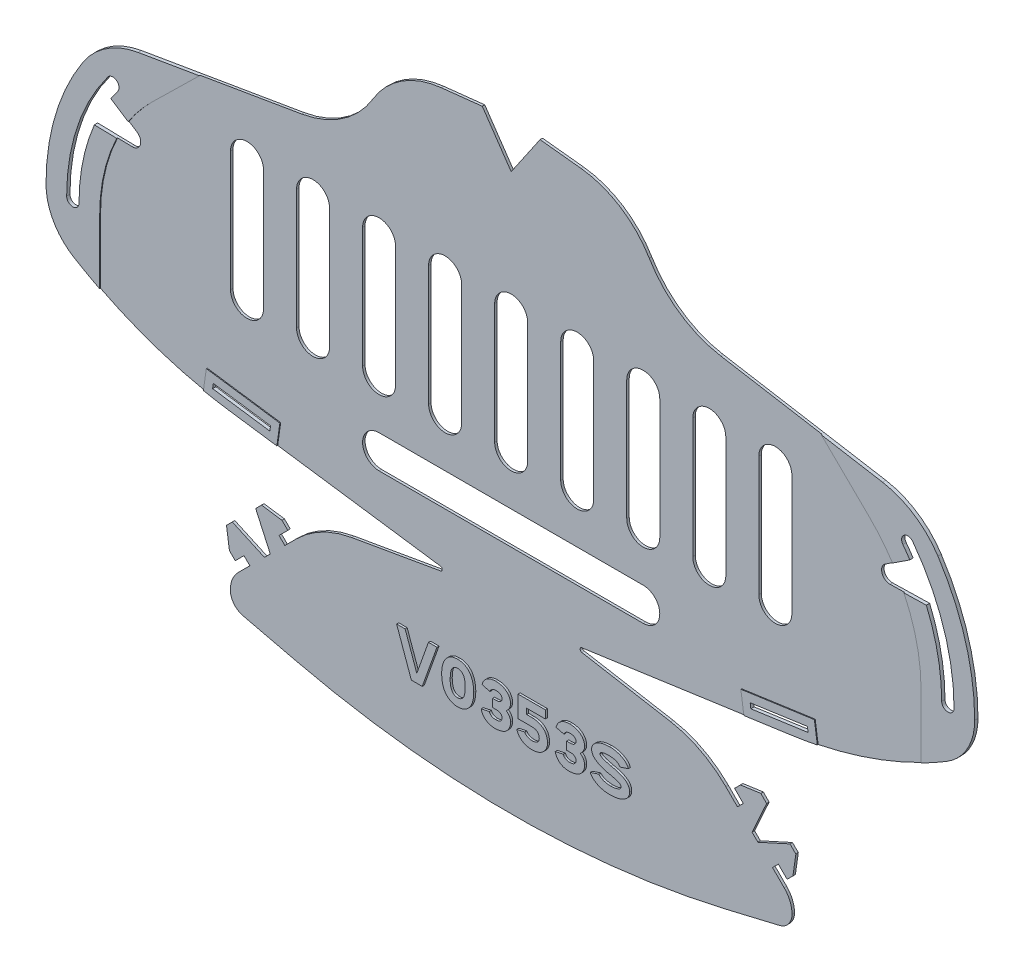
from build123d import *

# Parameters (mm, degrees)
MAIN_SHAPE_DEPTH                   = 0.6
ELASTIC_ATTACHMENT_POINTS_DEPTH    = 184.525502315
REINFORCED_ATTACHMENT_POINTS_DEPTH = 0.2
TAB_SLITS_DEPTH                    = 184.525502315
REINFORCED_TAB_SLITS_DEPTH         = 0.2
TAB_FLEX_RELIEF_DEPTH              = 184.525502315
TAB_FLEX_RELIEF_DEPTH_BACK         = 184.525502315
BREATHING_SLITS_DEPTH              = 184.525502315
VERSION_NUMBER_DEPTH               = 0.5
FILLET1_R                          = 0.5
CUT_EXTRUDE1_DEPTH                 = 184.526265229
CUT_EXTRUDE1_DEPTH_BACK            = 184.526265229


with BuildPart() as part:
    # Sketch1 → Main Shape (new body)
    with BuildSketch(Plane.XY):
        with BuildLine():
            Line((0, -10.235233266), (-7, 0))
            Line((-7, 0), (-16.941855461, -1.076805455))
            ThreePointArc((-16.941855461, -1.076805455), (-26.448172688, -4.42923559), (-33.461443341, -11.669600897))
            ThreePointArc((-33.461443341, -11.669600897), (-40.804108255, -19.481824954), (-50.74391922, -23.5))
            Line((-50.74391922, -23.5), (-90.180351554, -30.190874742))
            ThreePointArc((-90.180351554, -30.190874742), (-97.811505455, -33.190405434), (-103.597722286, -39))
            ThreePointArc((-103.597722286, -39), (-110.227482046, -53.35351039), (-112.5, -69))
            ThreePointArc((-112.5, -69), (-110.685143325, -75.893640703), (-105.711102551, -81))
            ThreePointArc((-105.711102551, -81), (-87.655491519, -89.524485559), (-68.266232563, -94.291935705))
            Line((-68.266232563, -94.291935705), (-14, -102))
            Line((-14, -102), (-38.626554922, -106.304973016))
            ThreePointArc((-38.626554922, -106.304973016), (-45.849449199, -108.748014338), (-52, -113.254607005))
            Line((-52, -113.254607005), (-54.828307349, -116.0831539))
            Line((-54.828307349, -116.0831539), (-56.242580797, -114.669000226))
            Line((-56.242580797, -114.669000226), (-54.121350285, -112.547590054))
            Line((-54.121350285, -112.547590054), (-55.535623732, -111.13343638))
            Line((-55.535623732, -111.13343638), (-60.48540114, -110.426539202))
            Line((-60.48540114, -110.426539202), (-68.970323187, -118.912179887))
            Line((-68.970323187, -118.912179887), (-68.263006804, -123.861897408))
            Line((-68.263006804, -123.861897408), (-66.848733357, -125.276051082))
            Line((-66.848733357, -125.276051082), (-64.727502845, -123.154640911))
            Line((-64.727502845, -123.154640911), (-63.313229397, -124.568794586))
            Line((-63.313229397, -124.568794586), (-66.141536747, -127.397341481))
            ThreePointArc((-66.141536747, -127.397341481), (-67.550417669, -129.506025763), (-68.045148042, -131.993340924))
            ThreePointArc((-68.045148042, -131.993340924), (-67.183295285, -134.473669911), (-64.9691321, -135.885159709))
            Line((-64.9691321, -135.885159709), (-52.436095294, -138.860716087))
            ThreePointArc((-52.436095294, -138.860716087), (-26.397134772, -143.459954927), (0, -145))
            ThreePointArc((0, -145), (26.397134772, -143.459954927), (52.436095294, -138.860716087))
            Line((52.436095294, -138.860716087), (64.9691321, -135.885159709))
            ThreePointArc((64.9691321, -135.885159709), (67.183295285, -134.473669911), (68.045148042, -131.993340924))
            ThreePointArc((68.045148042, -131.993340924), (67.550417669, -129.506025763), (66.141536747, -127.397341481))
            Line((66.141536747, -127.397341481), (63.313229397, -124.568794586))
            Line((63.313229397, -124.568794586), (64.727502845, -123.154640911))
            Line((64.727502845, -123.154640911), (66.848733357, -125.276051082))
            Line((66.848733357, -125.276051082), (68.263006804, -123.861897408))
            Line((68.263006804, -123.861897408), (68.970323187, -118.912179887))
            Line((68.970323187, -118.912179887), (60.48540114, -110.426539202))
            Line((60.48540114, -110.426539202), (55.535623732, -111.13343638))
            Line((55.535623732, -111.13343638), (54.121350285, -112.547590054))
            Line((54.121350285, -112.547590054), (56.242580797, -114.669000226))
            Line((56.242580797, -114.669000226), (54.828307349, -116.0831539))
            Line((54.828307349, -116.0831539), (52, -113.254607005))
            ThreePointArc((52, -113.254607005), (45.849449199, -108.748014338), (38.626554922, -106.304973016))
            Line((38.626554922, -106.304973016), (14, -102))
            Line((14, -102), (68.266232563, -94.291935705))
            ThreePointArc((68.266232563, -94.291935705), (87.655491519, -89.524485559), (105.711102551, -81))
            ThreePointArc((105.711102551, -81), (110.685143325, -75.893640703), (112.5, -69))
            ThreePointArc((112.5, -69), (110.227482046, -53.35351039), (103.597722286, -39))
            ThreePointArc((103.597722286, -39), (97.811505455, -33.190405434), (90.180351554, -30.190874742))
            Line((90.180351554, -30.190874742), (50.74391922, -23.5))
            ThreePointArc((50.74391922, -23.5), (40.804108255, -19.481824954), (33.461443341, -11.669600897))
            ThreePointArc((33.461443341, -11.669600897), (26.448172688, -4.42923559), (16.941855461, -1.076805455))
            Line((16.941855461, -1.076805455), (7, 0))
            Line((7, 0), (0, -10.235233266))
        make_face()
    extrude(amount=MAIN_SHAPE_DEPTH)

    # Sketch2 → Elastic Attachment Points (cut, through all)
    with BuildSketch(Plane.XY.offset(0.6)):
        with BuildLine():
            ThreePointArc((-97.5, -39), (-104.934164903, -53.188611699), (-107.5, -69))
            ThreePointArc((-107.5, -69), (-106, -70.5), (-104.5, -69))
            ThreePointArc((-104.5, -69), (-102.088115008, -54.137294997), (-95.1, -40.8))
            ThreePointArc((-95.1, -40.8), (-95.4, -38.7), (-97.5, -39))
        make_face()
        with BuildLine():
            ThreePointArc((97.5, -39), (104.934164903, -53.188611699), (107.5, -69))
            ThreePointArc((107.5, -69), (106, -70.5), (104.5, -69))
            ThreePointArc((104.5, -69), (102.088115008, -54.137294997), (95.1, -40.8))
            ThreePointArc((95.1, -40.8), (95.4, -38.7), (97.5, -39))
        make_face()
    extrude(amount=-ELASTIC_ATTACHMENT_POINTS_DEPTH, mode=Mode.SUBTRACT)

    # Sketch7 → Reinforced Attachment Points (add)
    # profile 1 of 2: a face of its own
    with BuildSketch(Plane.XY.offset(0.6)):
        with BuildLine():
            Line((-99.5, -69), (-99.5, -84.438405623))
            ThreePointArc((-99.5, -84.438405623), (-102.636073846, -82.774338486), (-105.711102551, -81))
            ThreePointArc((-105.711102551, -81), (-110.685143325, -75.893640703), (-112.5, -69))
            ThreePointArc((-112.5, -69), (-110.227482046, -53.35351039), (-103.597722286, -39))
            ThreePointArc((-103.597722286, -39), (-97.811505455, -33.190405434), (-90.180351554, -30.190874742))
            Line((-90.180351554, -30.190874742), (-75.331937335, -27.671659038))
            Line((-75.331937335, -27.671659038), (-86.893876913, -39))
            ThreePointArc((-86.893876913, -39), (-96.22042633, -52.729517991), (-99.5, -69))
        make_face()
        with BuildLine():
            ThreePointArc((-107.5, -69), (-106, -70.5), (-104.5, -69))
            ThreePointArc((-104.5, -69), (-102.088115008, -54.137294997), (-95.1, -40.8))
            ThreePointArc((-95.1, -40.8), (-95.4, -38.7), (-97.5, -39))
            ThreePointArc((-97.5, -39), (-104.934164903, -53.188611699), (-107.5, -69))
        make_face(mode=Mode.SUBTRACT)
    # profile 2 of 2: a face of its own
    with BuildSketch(Plane.XY.offset(0.6)):
        with BuildLine():
            Line((75.331937335, -27.671659038), (90.180351554, -30.190874742))
            ThreePointArc((90.180351554, -30.190874742), (97.811505455, -33.190405434), (103.597722286, -39))
            ThreePointArc((103.597722286, -39), (110.227482046, -53.35351039), (112.5, -69))
            ThreePointArc((112.5, -69), (110.685143325, -75.893640703), (105.711102551, -81))
            ThreePointArc((105.711102551, -81), (102.636073846, -82.774338486), (99.5, -84.438405623))
            Line((99.5, -84.438405623), (99.5, -69))
            ThreePointArc((99.5, -69), (96.22042633, -52.729517991), (86.893876913, -39))
            Line((86.893876913, -39), (75.331937335, -27.671659038))
        make_face()
        with BuildLine():
            ThreePointArc((104.5, -69), (106, -70.5), (107.5, -69))
            ThreePointArc((107.5, -69), (104.934164903, -53.188611699), (97.5, -39))
            ThreePointArc((97.5, -39), (95.4, -38.7), (95.1, -40.8))
            ThreePointArc((95.1, -40.8), (102.088115008, -54.137294997), (104.5, -69))
        make_face(mode=Mode.SUBTRACT)
    extrude(amount=REINFORCED_ATTACHMENT_POINTS_DEPTH)

    # Sketch6 → Tab Slits (cut, through all)
    with BuildSketch(Plane.XY.offset(0.6)):
        Polygon((-72.13241053, -91.7227024), (-58.271539531, -93.691523152), (-58.102783467, -92.503448495), (-71.963654466, -90.534627743), align=None)
        Polygon((72.13241053, -91.7227024), (71.963654466, -90.534627743), (58.102783467, -92.503448495), (58.271539531, -93.691523152), align=None)
    extrude(amount=-TAB_SLITS_DEPTH, mode=Mode.SUBTRACT)

    # Sketch9 → Reinforced Tab Slits (add)
    # profile 1 of 2: a face of its own
    with BuildSketch(Plane.XY.offset(0.6)):
        with BuildLine():
            Line((-56.57267521, -95.952907688), (-55.841398931, -90.804584174))
            Line((-55.841398931, -90.804584174), (-73.662518786, -88.273243207))
            Line((-73.662518786, -88.273243207), (-74.366835359, -93.231765281))
            ThreePointArc((-74.366835359, -93.231765281), (-71.324741696, -93.809080757), (-68.266232563, -94.291935705))
            Line((-68.266232563, -94.291935705), (-56.57267521, -95.952907688))
        make_face()
        Polygon((-58.271539531, -93.691523152), (-58.102783467, -92.503448495), (-71.963654466, -90.534627743), (-72.13241053, -91.7227024), align=None, mode=Mode.SUBTRACT)
    # profile 2 of 2: a face of its own
    with BuildSketch(Plane.XY.offset(0.6)):
        with BuildLine():
            Line((68.266232563, -94.291935705), (56.57267521, -95.952907688))
            Line((56.57267521, -95.952907688), (55.841398931, -90.804584174))
            Line((55.841398931, -90.804584174), (73.662518786, -88.273243207))
            Line((73.662518786, -88.273243207), (74.366835359, -93.231765281))
            ThreePointArc((74.366835359, -93.231765281), (71.324741696, -93.809080757), (68.266232563, -94.291935705))
        make_face()
        Polygon((58.102783467, -92.503448495), (71.963654466, -90.534627743), (72.13241053, -91.7227024), (58.271539531, -93.691523152), align=None, mode=Mode.SUBTRACT)
    extrude(amount=REINFORCED_TAB_SLITS_DEPTH)

    # Sketch11 → Tab Flex Relief (cut, two sides: drawn at the far end of the back side and taken through both)
    with BuildSketch(Plane.XY.offset(0.6).offset(-TAB_FLEX_RELIEF_DEPTH_BACK)):
        Polygon((-67.556169513, -117.49790644), (-59.777845211, -121.033110967), (-58.363691536, -119.618837519), (-61.899554814, -111.840812649), align=None)
        Polygon((61.899554814, -111.840812649), (67.556169513, -117.49790644), (59.777845211, -121.033110967), (58.363691536, -119.618837519), align=None)
    extrude(amount=TAB_FLEX_RELIEF_DEPTH + TAB_FLEX_RELIEF_DEPTH_BACK, mode=Mode.SUBTRACT)

    # Sketch3 → Breathing Slits (cut, through all)
    with BuildSketch(Plane.XY.offset(0.6)):
        with BuildLine():
            Line((4, -39.9), (4, -69))
            ThreePointArc((4, -69), (0, -73), (-4, -69))
            Line((-4, -69), (-4, -39.9))
            ThreePointArc((-4, -39.9), (0, -35.9), (4, -39.9))
        make_face()
        with BuildLine():
            Line((-12, -39.9), (-12, -69))
            ThreePointArc((-12, -69), (-16, -73), (-20, -69))
            Line((-20, -69), (-20, -39.9))
            ThreePointArc((-20, -39.9), (-16, -35.9), (-12, -39.9))
        make_face()
        with BuildLine():
            Line((-28, -39.9), (-28, -69))
            ThreePointArc((-28, -69), (-32, -73), (-36, -69))
            Line((-36, -69), (-36, -39.9))
            ThreePointArc((-36, -39.9), (-32, -35.9), (-28, -39.9))
        make_face()
        with BuildLine():
            Line((-32, -81), (32, -81))
            ThreePointArc((32, -81), (36, -85), (32, -89))
            Line((32, -89), (-32, -89))
            ThreePointArc((-32, -89), (-36, -85), (-32, -81))
        make_face()
        with BuildLine():
            Line((-44, -39.9), (-44, -69))
            ThreePointArc((-44, -69), (-48, -73), (-52, -69))
            Line((-52, -69), (-52, -39.9))
            ThreePointArc((-52, -39.9), (-48, -35.9), (-44, -39.9))
        make_face()
        with BuildLine():
            Line((-60, -39.9), (-60, -69))
            ThreePointArc((-60, -69), (-64, -73), (-68, -69))
            Line((-68, -69), (-68, -39.9))
            ThreePointArc((-68, -39.9), (-64, -35.9), (-60, -39.9))
        make_face()
        with BuildLine():
            Line((12, -39.9), (12, -69))
            ThreePointArc((12, -69), (16, -73), (20, -69))
            Line((20, -69), (20, -39.9))
            ThreePointArc((20, -39.9), (16, -35.9), (12, -39.9))
        make_face()
        with BuildLine():
            Line((28, -39.9), (28, -69))
            ThreePointArc((28, -69), (32, -73), (36, -69))
            Line((36, -69), (36, -39.9))
            ThreePointArc((36, -39.9), (32, -35.9), (28, -39.9))
        make_face()
        with BuildLine():
            Line((44, -39.9), (44, -69))
            ThreePointArc((44, -69), (48, -73), (52, -69))
            Line((52, -69), (52, -39.9))
            ThreePointArc((52, -39.9), (48, -35.9), (44, -39.9))
        make_face()
        with BuildLine():
            Line((60, -39.9), (60, -69))
            ThreePointArc((60, -69), (64, -73), (68, -69))
            Line((68, -69), (68, -39.9))
            ThreePointArc((68, -39.9), (64, -35.9), (60, -39.9))
        make_face()
    extrude(amount=-BREATHING_SLITS_DEPTH, mode=Mode.SUBTRACT)

    # Sketch8 → Version Number (add)
    # profile 1 of 6: a face of its own
    with BuildSketch(Plane.XY.offset(0.6)):
        Polygon((-23.68563445, -128.5), (-21.050713815, -128.5), (-17.479285243, -118.5), (-19.542777307, -118.5), (-22.368174132, -126.420634921), (-25.193570958, -118.5), (-27.257063021, -118.5), align=None)
    # profile 2 of 6: a face of its own
    with BuildSketch(Plane.XY.offset(0.6)):
        with BuildLine():
            add(Edge.make_bspline(
                [(-12.457110564, -118.5), (-12.601476528, -118.505695671), (-12.884231675, -118.51685121), (-13.297366677, -118.5745591), (-13.68520938, -118.680335178), (-14.052410955, -118.819656178), (-14.394686527, -119.003303471), (-14.718479702, -119.221085059), (-15.011490317, -119.487440084), (-15.28694537, -119.785519386), (-15.53280855, -120.12453761), (-15.74624426, -120.500892889), (-15.928207036, -120.912503383), (-16.0771282, -121.360169436), (-16.192677248, -121.844506854), (-16.280431187, -122.364485904), (-16.331985627, -122.921030718), (-16.342642357, -123.303893775), (-16.348120938, -123.500722112)],
                knots=[0, 0, 0, 0, 0.970159994, 1.900155169, 2.79438565, 3.665191596, 4.532301255, 5.397946305, 6.279238358, 7.185391655, 8.120220805, 9.085107467, 10.08639026, 11.138349125, 12.249459105, 13.427760297, 14.677622047, 16, 16, 16, 16], degree=3))
            add(Edge.make_bspline(
                [(-16.348120938, -123.500722112), (-16.342697547, -123.69832053), (-16.332188921, -124.081196856), (-16.280221851, -124.637697099), (-16.192775961, -125.156966907), (-16.076666105, -125.641884177), (-15.928723442, -126.090648826), (-15.746176817, -126.502814664), (-15.532866512, -126.879260377), (-15.286785332, -127.218032326), (-15.012393595, -127.51659595), (-14.716926049, -127.779877259), (-14.395574806, -128.000979952), (-14.052217501, -128.183632701), (-13.685664447, -128.324409639), (-13.296711367, -128.425104033), (-12.884933047, -128.488808035), (-12.602151673, -128.496221224), (-12.458007598, -128.5)],
                knots=[0, 0, 0, 0, 1.327400251, 2.57203543, 3.750234214, 4.861247624, 5.917991082, 6.919186852, 7.883989653, 8.818737555, 9.724812096, 10.602616666, 11.47109776, 12.338132057, 13.208862319, 14.101698703, 15.032365954, 16, 16, 16, 16], degree=3))
            add(Edge.make_bspline(
                [(-12.458007598, -128.5), (-12.313867929, -128.496210687), (-12.0310952, -128.488776824), (-11.619254786, -128.425221319), (-11.229832454, -128.323813307), (-10.862470976, -128.184839888), (-10.520081497, -128.000200623), (-10.199035091, -127.779984633), (-9.903636422, -127.516566079), (-9.629226622, -127.218040576), (-9.383145995, -126.879258594), (-9.169853253, -126.502813072), (-8.987231376, -126.090657611), (-8.839593638, -125.641847927), (-8.722280788, -125.157235462), (-8.639838642, -124.637275213), (-8.582182417, -124.081441513), (-8.574272049, -123.698369528), (-8.570190665, -123.500722112)],
                knots=[0, 0, 0, 0, 0.96765053, 1.898333634, 2.791185227, 3.666728435, 4.529238626, 5.397734515, 6.275554038, 7.181644014, 8.116407839, 9.081227075, 10.082439899, 11.139201358, 12.250233695, 13.427610983, 14.672766316, 16, 16, 16, 16], degree=3))
            add(Edge.make_bspline(
                [(-8.570190665, -123.500722112), (-8.574331494, -123.303845261), (-8.582388199, -122.920787111), (-8.639632178, -122.364907693), (-8.722380372, -121.844238468), (-8.839130008, -121.360205444), (-8.987747973, -120.912494629), (-9.169785791, -120.500894477), (-9.383203968, -120.124539393), (-9.629066562, -119.785511139), (-9.904539799, -119.487469991), (-10.197481007, -119.220977415), (-10.52096587, -119.004075275), (-10.862277518, -118.818455332), (-11.230288081, -118.680915067), (-11.618604713, -118.574534625), (-12.031453791, -118.516562336), (-12.313938622, -118.506550382), (-12.458007598, -118.501444225)],
                knots=[0, 0, 0, 0, 1.322391154, 2.572941942, 3.750582404, 4.861863084, 5.913983562, 6.915420183, 7.880455081, 8.815427849, 9.721720359, 10.603147806, 11.468925845, 12.331628829, 13.207367743, 14.101735605, 15.031873656, 16, 16, 16, 16], degree=3))
            Line((-12.458007598, -118.501444225), (-12.457110564, -118.5))
        make_face()
        with BuildLine():
            add(Edge.make_bspline(
                [(-12.457110564, -126.579365079), (-12.526430112, -126.580142247), (-12.662440437, -126.581667111), (-12.859893674, -126.549518886), (-13.046344769, -126.50001124), (-13.220522065, -126.424863461), (-13.384317425, -126.32888552), (-13.534932969, -126.207295998), (-13.673291992, -126.063513987), (-13.80060705, -125.896932623), (-13.914478352, -125.703005633), (-14.013009341, -125.478827118), (-14.093746756, -125.222713054), (-14.162923514, -124.937433189), (-14.214174879, -124.621763618), (-14.252678444, -124.276117752), (-14.278545108, -123.899148475), (-14.281904383, -123.63702081), (-14.283651108, -123.500722112)],
                knots=[0, 0, 0, 0, 0.820209436, 1.609314487, 2.362064528, 3.101854642, 3.850272983, 4.605479342, 5.3882482, 6.210255141, 7.084711649, 8.047345167, 9.106040688, 10.263495908, 11.523832392, 12.893430008, 14.384674726, 16, 16, 16, 16], degree=3))
            add(Edge.make_bspline(
                [(-14.283651108, -123.500722112), (-14.281897496, -123.364424703), (-14.278524977, -123.102299516), (-14.252749333, -122.725313211), (-14.213856358, -122.378974061), (-14.163560074, -122.063111109), (-14.093342651, -121.778059679), (-14.01303962, -121.522619394), (-13.91450946, -121.298401339), (-13.8004748, -121.104640769), (-13.674084496, -120.937923887), (-13.53412201, -120.796456824), (-13.384401259, -120.674830172), (-13.220561374, -120.578630118), (-13.045915354, -120.50465551), (-12.860547807, -120.450210023), (-12.662404099, -120.423926373), (-12.526960826, -120.422146526), (-12.458007598, -120.421240419)],
                knots=[0, 0, 0, 0, 1.616177311, 3.108208617, 4.478528655, 5.748482895, 6.897727805, 7.956981757, 8.920123036, 9.795040793, 10.617481319, 11.394165711, 12.149770419, 12.898583529, 13.63876386, 14.394368568, 15.182584207, 16, 16, 16, 16], degree=3))
            add(Edge.make_bspline(
                [(-12.458007598, -120.421240419), (-12.389055963, -120.422149219), (-12.253615818, -120.423934355), (-12.055449598, -120.450179948), (-11.87016301, -120.504762296), (-11.695829663, -120.577982734), (-11.533604328, -120.675595023), (-11.38413457, -120.796360516), (-11.244234324, -120.937948802), (-11.117870012, -121.104645093), (-11.003645274, -121.298351736), (-10.905859994, -121.523063414), (-10.821900135, -121.777554553), (-10.752711036, -122.063195246), (-10.702081358, -122.378948588), (-10.663289243, -122.725320897), (-10.637483579, -123.102297333), (-10.634115428, -123.364423957), (-10.632364088, -123.500722112)],
                knots=[0, 0, 0, 0, 0.817669415, 1.606129616, 2.361968767, 3.102378757, 3.843623451, 4.599462602, 5.376387978, 6.199083685, 7.074272906, 8.037713021, 9.100132017, 10.249733507, 11.520081779, 12.89082699, 14.383321233, 16, 16, 16, 16], degree=3))
            add(Edge.make_bspline(
                [(-10.632364088, -123.500722112), (-10.634108542, -123.637021556), (-10.63746345, -123.899150658), (-10.663360125, -124.276110066), (-10.701763075, -124.621789015), (-10.753346294, -124.937349474), (-10.821488159, -125.223220708), (-10.905889671, -125.478383327), (-11.003676527, -125.703055181), (-11.117737705, -125.896928348), (-11.245026848, -126.063488884), (-11.383322938, -126.207393621), (-11.533687028, -126.328120602), (-11.695868255, -126.425517476), (-11.869733505, -126.499891817), (-12.056102843, -126.549600883), (-12.253292471, -126.581404352), (-12.388991007, -126.580608552), (-12.458007598, -126.580203806)],
                knots=[0, 0, 0, 0, 1.616177474, 3.108208932, 4.478529109, 5.739530511, 6.897596372, 7.959685938, 8.922827315, 9.797745161, 10.620185771, 11.403367596, 12.15897238, 12.899987232, 13.640167639, 14.39331481, 15.182836171, 16, 16, 16, 16], degree=3))
            Line((-12.458007598, -126.580203806), (-12.457110564, -126.579365079))
        make_face(mode=Mode.SUBTRACT)
    # profile 3 of 6: a face of its own
    with BuildSketch(Plane.XY.offset(0.6)):
        with BuildLine():
            Line((-3.134505757, -124.404761905), (-3.039267661, -124.404761905))
            add(Edge.make_bspline(
                [(-3.039267661, -124.404761905), (-2.938999766, -124.411299477), (-2.748364565, -124.423729091), (-2.481698268, -124.486416557), (-2.24890418, -124.578961335), (-2.057216802, -124.709274647), (-1.903571501, -124.861365804), (-1.789244062, -125.032278467), (-1.719582818, -125.222537651), (-1.710707381, -125.355662585), (-1.706230349, -125.422814713)],
                knots=[0, 0, 0, 0, 1.293250512, 2.458803691, 3.516087315, 4.504014474, 5.424976382, 6.287022232, 7.135923681, 8, 8, 8, 8], degree=3))
            add(Edge.make_bspline(
                [(-1.706230349, -125.422814713), (-1.7095199, -125.504440638), (-1.715880886, -125.662280257), (-1.785028257, -125.887718235), (-1.903383115, -126.087113891), (-2.038298952, -126.23073656), (-2.167463607, -126.331172702), (-2.282352603, -126.395688771), (-2.411203502, -126.450185226), (-2.554231508, -126.49595932), (-2.710952968, -126.532200484), (-2.881911905, -126.560253509), (-3.067735627, -126.575366879), (-3.196574623, -126.5785552), (-3.263194248, -126.580203806)],
                knots=[0, 0, 0, 0, 1.334208421, 2.579951764, 3.816761299, 5.103436918, 5.78324123, 6.491044783, 7.25516555, 8.072210043, 8.94833879, 9.888551629, 10.908219533, 12, 12, 12, 12], degree=3))
            add(Edge.make_bspline(
                [(-3.263194248, -126.580203806), (-3.337587839, -126.579024673), (-3.488072432, -126.576639503), (-3.714718978, -126.537785365), (-3.942993936, -126.472292557), (-4.170091336, -126.384048723), (-4.384247936, -126.26078738), (-4.561570465, -126.088542309), (-4.702740221, -125.87591894), (-4.757309375, -125.712337396), (-4.785712043, -125.62719493)],
                knots=[0, 0, 0, 0, 0.920255672, 1.861508472, 2.836752399, 3.857684402, 4.873720033, 5.872631744, 6.892727297, 8, 8, 8, 8], degree=3))
            Line((-4.785712043, -125.62719493), (-6.769426392, -126.071428571))
            add(Edge.make_bspline(
                [(-6.769426392, -126.071428571), (-6.746591107, -126.160336196), (-6.701634962, -126.335369884), (-6.608626083, -126.586847228), (-6.497188646, -126.824009097), (-6.372032302, -127.050933458), (-6.223881215, -127.26169635), (-6.059712676, -127.459934114), (-5.880481147, -127.647890635), (-5.680148854, -127.819546753), (-5.462701876, -127.976110236), (-5.225555302, -128.112422888), (-4.970989804, -128.230322428), (-4.695452415, -128.322934743), (-4.403334799, -128.399729339), (-4.09206623, -128.45295857), (-3.763235251, -128.491934936), (-3.537353759, -128.497268097), (-3.421646326, -128.5)],
                knots=[0, 0, 0, 0, 0.97897001, 1.927311989, 2.855460552, 3.773345826, 4.68872018, 5.599601379, 6.518067916, 7.456260856, 8.41049365, 9.372940738, 10.370680865, 11.39871829, 12.470472684, 13.590411754, 14.765692276, 16, 16, 16, 16], degree=3))
            add(Edge.make_bspline(
                [(-3.421646326, -128.5), (-3.265376441, -128.494245394), (-2.96285039, -128.483104934), (-2.525041601, -128.435865678), (-2.119393219, -128.358387224), (-1.745618427, -128.252017359), (-1.400744734, -128.123277608), (-1.089759313, -127.961059217), (-0.807667878, -127.774497038), (-0.560013856, -127.55815064), (-0.345619143, -127.319870658), (-0.153861569, -127.071551477), (0.003927722, -126.805353082), (0.136458376, -126.527874631), (0.235086, -126.234513517), (0.306549704, -125.928607165), (0.348222105, -125.607680152), (0.353339739, -125.38925418), (0.355943074, -125.278141077)],
                knots=[0, 0, 0, 0, 1.338573179, 2.591371041, 3.766159492, 4.869841347, 5.915366975, 6.911991706, 7.866279139, 8.804635322, 9.718527085, 10.607232931, 11.486170613, 12.362759498, 13.235296616, 14.130311397, 15.048891017, 16, 16, 16, 16], degree=3))
            add(Edge.make_bspline(
                [(0.355943074, -125.278141077), (0.350594647, -125.181448476), (0.340067888, -124.991138356), (0.284752303, -124.713321084), (0.192392415, -124.451246621), (0.063200676, -124.20784025), (-0.087999029, -123.977552327), (-0.263130446, -123.764837772), (-0.457527492, -123.566155092), (-0.601952158, -123.449574998), (-0.675143638, -123.39049458)],
                knots=[0, 0, 0, 0, 1.042147361, 2.051151675, 3.039496243, 4.024119517, 5.012016893, 6.002285516, 6.987598979, 8, 8, 8, 8], degree=3))
            add(Edge.make_bspline(
                [(-0.675143638, -123.39049458), (-0.601962603, -123.325162044), (-0.457601846, -123.19628365), (-0.263329724, -122.981710509), (-0.089159018, -122.755542958), (0.064196734, -122.515248899), (0.191398258, -122.261642739), (0.284222347, -121.993228321), (0.340130611, -121.711764564), (0.350615998, -121.519933272), (0.355943074, -121.42247384)],
                knots=[0, 0, 0, 0, 1.026734164, 2.025389794, 3.025877614, 4.013273499, 5.006315215, 5.989929209, 6.978788314, 8, 8, 8, 8], degree=3))
            add(Edge.make_bspline(
                [(0.355943074, -121.42247384), (0.351861209, -121.322020203), (0.34384223, -121.124675201), (0.296899532, -120.835115028), (0.221721518, -120.558271626), (0.114279461, -120.294880847), (-0.019136135, -120.042407113), (-0.18394805, -119.803370965), (-0.374977228, -119.574583887), (-0.595808086, -119.361344215), (-0.842507244, -119.166999953), (-1.114315461, -118.995833154), (-1.40885415, -118.84746887), (-1.729630203, -118.730513446), (-2.07154582, -118.632405283), (-2.437425656, -118.562780212), (-2.826500811, -118.515976725), (-3.093888902, -118.506371293), (-3.231044551, -118.501444225)],
                knots=[0, 0, 0, 0, 0.933249724, 1.833404674, 2.71837752, 3.592513965, 4.4704886, 5.365912677, 6.284554944, 7.234984132, 8.212272519, 9.196674926, 10.214289296, 11.269589965, 12.363543901, 13.515449053, 14.72555956, 16, 16, 16, 16], degree=3))
            add(Edge.make_bspline(
                [(-3.231044551, -118.501444225), (-3.344436904, -118.504384419), (-3.565617663, -118.510119502), (-3.888401932, -118.546209564), (-4.194231237, -118.597359567), (-4.483049963, -118.671164203), (-4.75409352, -118.76520159), (-5.007815603, -118.877770477), (-5.244345137, -119.009217236), (-5.461948407, -119.161041577), (-5.662208983, -119.328960798), (-5.843605971, -119.510905494), (-6.008352964, -119.704452098), (-6.15288714, -119.91288512), (-6.282516615, -120.132286581), (-6.389051644, -120.36651166), (-6.483970603, -120.610059019), (-6.527374821, -120.780460499), (-6.549352566, -120.866743363)],
                knots=[0, 0, 0, 0, 1.229240767, 2.397731417, 3.51786287, 4.588673614, 5.625367482, 6.624717489, 7.594406979, 8.554388623, 9.496885304, 10.424058211, 11.336820069, 12.248524965, 13.170856983, 14.095351914, 15.035580601, 16, 16, 16, 16], degree=3))
            Line((-6.549352566, -120.866743363), (-4.642442265, -121.373015873))
            add(Edge.make_bspline(
                [(-4.642442265, -121.373015873), (-4.631144614, -121.326631527), (-4.606628439, -121.22597637), (-4.516127311, -121.081457089), (-4.394278637, -120.927147787), (-4.233065862, -120.771324055), (-4.035688089, -120.625559671), (-3.797598111, -120.514206488), (-3.524513725, -120.446844288), (-3.331684287, -120.430020784), (-3.231044551, -120.421240419)],
                knots=[0, 0, 0, 0, 0.626586808, 1.359708585, 2.222843852, 3.223153095, 4.308434095, 5.447412619, 6.667777482, 8, 8, 8, 8], degree=3))
            add(Edge.make_bspline(
                [(-3.231044551, -120.421240419), (-3.159011565, -120.423218633), (-3.020776076, -120.42701494), (-2.823372755, -120.449676308), (-2.643081127, -120.474391788), (-2.482031721, -120.515621967), (-2.336416714, -120.558109891), (-2.211807528, -120.618078056), (-2.101046193, -120.680273756), (-1.986142505, -120.780934624), (-1.871814515, -120.912654377), (-1.768820562, -121.077310889), (-1.708823547, -121.24921056), (-1.707084479, -121.365405566), (-1.706230349, -121.42247384)],
                knots=[0, 0, 0, 0, 1.26888152, 2.435057415, 3.499383416, 4.470882074, 5.362320585, 6.164854387, 6.902680001, 7.591682225, 8.843898063, 9.963361673, 10.999720905, 12, 12, 12, 12], degree=3))
            add(Edge.make_bspline(
                [(-1.706230349, -121.42247384), (-1.711301103, -121.49199044), (-1.721379302, -121.630155711), (-1.796658114, -121.827940252), (-1.918183427, -122.008163808), (-2.081510174, -122.171288708), (-2.288846082, -122.307565764), (-2.536383058, -122.408872593), (-2.823263391, -122.47003825), (-3.027118235, -122.480300003), (-3.13459546, -122.485710249)],
                knots=[0, 0, 0, 0, 0.842573162, 1.674626639, 2.532888499, 3.465967991, 4.458251597, 5.524776888, 6.695002246, 8, 8, 8, 8], degree=3))
            Line((-3.13459546, -122.485710249), (-3.991648614, -122.484126984))
            Line((-3.991648614, -122.484126984), (-3.991648614, -124.404761905))
            Line((-3.991648614, -124.404761905), (-3.134505757, -124.404761905))
        make_face()
    # profile 4 of 6: a face of its own
    with BuildSketch(Plane.XY.offset(0.6)):
        with BuildLine():
            Line((5.513206582, -121.753968254), (4.227492297, -121.753968254))
            Line((4.227492297, -121.753968254), (4.227492297, -120.420634921))
            Line((4.227492297, -120.420634921), (8.767174836, -120.420634921))
            Line((8.767174836, -120.420634921), (8.767174836, -118.5))
            Line((8.767174836, -118.5), (2.164000233, -118.5))
            Line((2.164000233, -118.5), (2.164000233, -123.674603175))
            Line((2.164000233, -123.674603175), (5.433841503, -123.674603175))
            add(Edge.make_bspline(
                [(5.433841503, -123.674603175), (5.507930852, -123.675602086), (5.651882888, -123.677542922), (5.861329513, -123.692704514), (6.05684756, -123.723042675), (6.238371079, -123.763288516), (6.405471398, -123.817251662), (6.560059339, -123.879484934), (6.697677714, -123.959553064), (6.825057655, -124.046197885), (6.933941045, -124.149968295), (7.030084091, -124.26484275), (7.113107688, -124.390602025), (7.179470037, -124.530129867), (7.232457955, -124.680251755), (7.271364362, -124.842608973), (7.29670935, -125.017132432), (7.302100449, -125.137973815), (7.304870446, -125.200063241)],
                knots=[0, 0, 0, 0, 1.291340122, 2.50901164, 3.656233385, 4.737231688, 5.745647761, 6.71445312, 7.634539433, 8.515488686, 9.393300537, 10.245701923, 11.122702301, 12.011797026, 12.93168986, 13.892747604, 14.917274139, 16, 16, 16, 16], degree=3))
            add(Edge.make_bspline(
                [(7.304870446, -125.200063241), (7.300658095, -125.300114528), (7.292573823, -125.492131264), (7.212308244, -125.765733398), (7.073166749, -126.004538024), (6.914556358, -126.17434082), (6.762800183, -126.290319351), (6.631069438, -126.365431401), (6.485634019, -126.430026061), (6.325287657, -126.482096845), (6.151494187, -126.52675039), (5.961317545, -126.55439299), (5.757617971, -126.576932347), (5.616318123, -126.5790915), (5.54352633, -126.580203806)],
                knots=[0, 0, 0, 0, 1.417186054, 2.719839454, 3.999831516, 5.306419273, 5.988605249, 6.704054952, 7.452945314, 8.243009127, 9.093975494, 9.995834141, 10.967537284, 12, 12, 12, 12], degree=3))
            add(Edge.make_bspline(
                [(5.54352633, -126.580203806), (5.434618302, -126.574841975), (5.223953995, -126.564470411), (4.919003779, -126.511605126), (4.63713077, -126.424404763), (4.38287353, -126.306180725), (4.161788136, -126.167710506), (3.989944323, -126.007163051), (3.858296858, -125.83604344), (3.817843784, -125.706158133), (3.798257063, -125.643269778)],
                knots=[0, 0, 0, 0, 1.239808568, 2.398201666, 3.511107812, 4.586578273, 5.581900341, 6.46310827, 7.255862013, 8, 8, 8, 8], degree=3))
            Line((3.798257063, -125.643269778), (1.878285948, -126.071428571))
            add(Edge.make_bspline(
                [(1.878285948, -126.071428571), (1.902355807, -126.160548359), (1.949986292, -126.336902466), (2.056060439, -126.587616399), (2.180619464, -126.825640703), (2.325123942, -127.052018478), (2.493904037, -127.263372267), (2.683738505, -127.462365132), (2.895223663, -127.648069148), (3.127231986, -127.81997371), (3.376402682, -127.975914274), (3.642650866, -128.111508549), (3.922150091, -128.229596507), (4.21871156, -128.322648571), (4.52840999, -128.399168227), (4.854034732, -128.452814481), (5.193559563, -128.491742739), (5.425529742, -128.49721594), (5.54352633, -128.5)],
                knots=[0, 0, 0, 0, 0.933358014, 1.846969395, 2.747978179, 3.65058438, 4.560476191, 5.481090533, 6.430749403, 7.405393302, 8.400725728, 9.402100456, 10.426556211, 11.46786461, 12.544569044, 13.652675183, 14.805983081, 16, 16, 16, 16], degree=3))
            add(Edge.make_bspline(
                [(5.54352633, -128.5), (5.680732693, -128.495504774), (5.949167634, -128.486710171), (6.340257636, -128.433418982), (6.712142263, -128.360336182), (7.061676359, -128.252803179), (7.392970191, -128.123435212), (7.700813999, -127.960769192), (7.990907585, -127.774871052), (8.256174477, -127.558743904), (8.495539761, -127.321416343), (8.708147688, -127.067668109), (8.883411847, -126.794179288), (9.036646935, -126.509027952), (9.149752963, -126.203081966), (9.235361929, -125.88344012), (9.288998998, -125.5470022), (9.299616778, -125.31737072), (9.305040882, -125.200063241)],
                knots=[0, 0, 0, 0, 1.17826532, 2.30519616, 3.385644728, 4.42967802, 5.441717964, 6.435616201, 7.414838536, 8.396397341, 9.367976222, 10.306520034, 11.232826888, 12.153236024, 13.081197769, 14.026829533, 14.992003824, 16, 16, 16, 16], degree=3))
            add(Edge.make_bspline(
                [(9.305040882, -125.200063241), (9.300900038, -125.073635127), (9.292791936, -124.826078875), (9.247268799, -124.463686468), (9.169190083, -124.120728156), (9.061207781, -123.797399283), (8.922851554, -123.493469509), (8.751869302, -123.211065096), (8.552856877, -122.946164208), (8.323477555, -122.703396477), (8.065184304, -122.484022512), (7.779351437, -122.292954639), (7.466249225, -122.131495081), (7.126748623, -121.998507068), (6.760902785, -121.892820854), (6.367966397, -121.818407366), (5.948880389, -121.769392953), (5.660017856, -121.760188975), (5.511376633, -121.755452845)],
                knots=[0, 0, 0, 0, 1.047845617, 2.051764646, 3.021184748, 3.957929711, 4.871890627, 5.782411277, 6.68821354, 7.612570783, 8.544147221, 9.490634628, 10.455228194, 11.457623096, 12.507540162, 13.606000757, 14.768109627, 16, 16, 16, 16], degree=3))
            Line((5.511376633, -121.755452845), (5.513206582, -121.753968254))
        make_face()
    # profile 5 of 6: a face of its own
    with BuildSketch(Plane.XY.offset(0.6)):
        with BuildLine():
            Line((14.795839557, -124.404761905), (14.891077652, -124.404761905))
            add(Edge.make_bspline(
                [(14.891077652, -124.404761905), (14.991345547, -124.411299477), (15.181980748, -124.423729091), (15.448647045, -124.486416557), (15.681441134, -124.578961335), (15.873128511, -124.709274647), (16.026773813, -124.861365804), (16.141101252, -125.032278467), (16.210762496, -125.222537651), (16.219637933, -125.355662585), (16.224114964, -125.422814713)],
                knots=[0, 0, 0, 0, 1.293250512, 2.458803691, 3.516087315, 4.504014474, 5.424976382, 6.287022232, 7.135923681, 8, 8, 8, 8], degree=3))
            add(Edge.make_bspline(
                [(16.224114964, -125.422814713), (16.220825414, -125.504440638), (16.214464428, -125.662280257), (16.145317056, -125.887718235), (16.026962198, -126.087113891), (15.892046362, -126.23073656), (15.762881706, -126.331172702), (15.64799271, -126.395688771), (15.519141811, -126.450185226), (15.376113805, -126.49595932), (15.219392346, -126.532200484), (15.048433409, -126.560253509), (14.862609686, -126.575366879), (14.73377069, -126.5785552), (14.667151065, -126.580203806)],
                knots=[0, 0, 0, 0, 1.334208421, 2.579951764, 3.816761299, 5.103436918, 5.78324123, 6.491044783, 7.25516555, 8.072210043, 8.94833879, 9.888551629, 10.908219533, 12, 12, 12, 12], degree=3))
            add(Edge.make_bspline(
                [(14.667151065, -126.580203806), (14.592757474, -126.579024673), (14.442272881, -126.576639503), (14.215626335, -126.537785365), (13.987351377, -126.472292557), (13.760253978, -126.384048723), (13.546097377, -126.26078738), (13.368774848, -126.088542309), (13.227605093, -125.87591894), (13.173035938, -125.712337396), (13.14463327, -125.62719493)],
                knots=[0, 0, 0, 0, 0.920255672, 1.861508472, 2.836752399, 3.857684402, 4.873720033, 5.872631744, 6.892727297, 8, 8, 8, 8], degree=3))
            Line((13.14463327, -125.62719493), (11.160918922, -126.071428571))
            add(Edge.make_bspline(
                [(11.160918922, -126.071428571), (11.183754206, -126.160336196), (11.228710351, -126.335369884), (11.32171923, -126.586847228), (11.433156668, -126.824009097), (11.558313011, -127.050933458), (11.706464098, -127.26169635), (11.870632637, -127.459934114), (12.049864167, -127.647890635), (12.250196459, -127.819546753), (12.467643437, -127.976110236), (12.704790011, -128.112422888), (12.959355509, -128.230322428), (13.234892898, -128.322934743), (13.527010514, -128.399729339), (13.838279083, -128.45295857), (14.167110062, -128.491934936), (14.392991554, -128.497268097), (14.508698987, -128.5)],
                knots=[0, 0, 0, 0, 0.97897001, 1.927311989, 2.855460552, 3.773345826, 4.68872018, 5.599601379, 6.518067916, 7.456260856, 8.41049365, 9.372940738, 10.370680865, 11.39871829, 12.470472684, 13.590411754, 14.765692276, 16, 16, 16, 16], degree=3))
            add(Edge.make_bspline(
                [(14.508698987, -128.5), (14.664968873, -128.494245394), (14.967494923, -128.483104934), (15.405303712, -128.435865678), (15.810952094, -128.358387224), (16.184726886, -128.252017359), (16.529600579, -128.123277608), (16.840586, -127.961059217), (17.122677435, -127.774497038), (17.370331457, -127.55815064), (17.58472617, -127.319870658), (17.776483744, -127.071551477), (17.934273035, -126.805353082), (18.066803689, -126.527874631), (18.165431313, -126.234513517), (18.236895017, -125.928607165), (18.278567418, -125.607680152), (18.283685052, -125.38925418), (18.286288387, -125.278141077)],
                knots=[0, 0, 0, 0, 1.338573179, 2.591371041, 3.766159492, 4.869841347, 5.915366975, 6.911991706, 7.866279139, 8.804635322, 9.718527085, 10.607232931, 11.486170613, 12.362759498, 13.235296616, 14.130311397, 15.048891017, 16, 16, 16, 16], degree=3))
            add(Edge.make_bspline(
                [(18.286288387, -125.278141077), (18.280939961, -125.181448476), (18.270413201, -124.991138356), (18.215097616, -124.713321084), (18.122737728, -124.451246621), (17.993545989, -124.20784025), (17.842346284, -123.977552327), (17.667214868, -123.764837772), (17.472817822, -123.566155092), (17.328393156, -123.449574998), (17.255201676, -123.39049458)],
                knots=[0, 0, 0, 0, 1.042147361, 2.051151675, 3.039496243, 4.024119517, 5.012016893, 6.002285516, 6.987598979, 8, 8, 8, 8], degree=3))
            add(Edge.make_bspline(
                [(17.255201676, -123.39049458), (17.32838271, -123.325162044), (17.472743467, -123.19628365), (17.667015589, -122.981710509), (17.841186295, -122.755542958), (17.994542047, -122.515248899), (18.121743571, -122.261642739), (18.214567661, -121.993228321), (18.270475924, -121.711764564), (18.280961311, -121.519933272), (18.286288387, -121.42247384)],
                knots=[0, 0, 0, 0, 1.026734164, 2.025389794, 3.025877614, 4.013273499, 5.006315215, 5.989929209, 6.978788314, 8, 8, 8, 8], degree=3))
            add(Edge.make_bspline(
                [(18.286288387, -121.42247384), (18.282206522, -121.322020203), (18.274187543, -121.124675201), (18.227244846, -120.835115028), (18.152066831, -120.558271626), (18.044624774, -120.294880847), (17.911209178, -120.042407113), (17.746397264, -119.803370965), (17.555368086, -119.574583887), (17.334537227, -119.361344215), (17.087838069, -119.166999953), (16.816029852, -118.995833154), (16.521491163, -118.84746887), (16.20071511, -118.730513446), (15.858799493, -118.632405283), (15.492919657, -118.562780212), (15.103844502, -118.515976725), (14.836456411, -118.506371293), (14.699300762, -118.501444225)],
                knots=[0, 0, 0, 0, 0.933249724, 1.833404674, 2.71837752, 3.592513965, 4.4704886, 5.365912677, 6.284554944, 7.234984132, 8.212272519, 9.196674926, 10.214289296, 11.269589965, 12.363543901, 13.515449053, 14.72555956, 16, 16, 16, 16], degree=3))
            add(Edge.make_bspline(
                [(14.699300762, -118.501444225), (14.58590841, -118.504384419), (14.364727651, -118.510119502), (14.041943381, -118.546209564), (13.736114076, -118.597359567), (13.44729535, -118.671164203), (13.176251793, -118.76520159), (12.92252971, -118.877770477), (12.686000176, -119.009217236), (12.468396906, -119.161041577), (12.268136331, -119.328960798), (12.086739343, -119.510905494), (11.921992349, -119.704452098), (11.777458173, -119.91288512), (11.647828698, -120.132286581), (11.541293669, -120.36651166), (11.44637471, -120.610059019), (11.402970492, -120.780460499), (11.380992747, -120.866743363)],
                knots=[0, 0, 0, 0, 1.229240767, 2.397731417, 3.51786287, 4.588673614, 5.625367482, 6.624717489, 7.594406979, 8.554388623, 9.496885304, 10.424058211, 11.336820069, 12.248524965, 13.170856983, 14.095351914, 15.035580601, 16, 16, 16, 16], degree=3))
            Line((11.380992747, -120.866743363), (13.287903049, -121.373015873))
            add(Edge.make_bspline(
                [(13.287903049, -121.373015873), (13.299200699, -121.326631527), (13.323716874, -121.22597637), (13.414218002, -121.081457089), (13.536066676, -120.927147787), (13.697279451, -120.771324055), (13.894657224, -120.625559671), (14.132747202, -120.514206488), (14.405831589, -120.446844288), (14.598661026, -120.430020784), (14.699300762, -120.421240419)],
                knots=[0, 0, 0, 0, 0.626586808, 1.359708585, 2.222843852, 3.223153095, 4.308434095, 5.447412619, 6.667777482, 8, 8, 8, 8], degree=3))
            add(Edge.make_bspline(
                [(14.699300762, -120.421240419), (14.771333748, -120.423218633), (14.909569237, -120.42701494), (15.106972559, -120.449676308), (15.287264186, -120.474391788), (15.448313592, -120.515621967), (15.593928599, -120.558109891), (15.718537785, -120.618078056), (15.82929912, -120.680273756), (15.944202808, -120.780934624), (16.058530799, -120.912654377), (16.161524751, -121.077310889), (16.221521766, -121.24921056), (16.223260834, -121.365405566), (16.224114964, -121.42247384)],
                knots=[0, 0, 0, 0, 1.26888152, 2.435057415, 3.499383416, 4.470882074, 5.362320585, 6.164854387, 6.902680001, 7.591682225, 8.843898063, 9.963361673, 10.999720905, 12, 12, 12, 12], degree=3))
            add(Edge.make_bspline(
                [(16.224114964, -121.42247384), (16.21904421, -121.49199044), (16.208966011, -121.630155711), (16.133687199, -121.827940252), (16.012161886, -122.008163808), (15.848835139, -122.171288708), (15.641499231, -122.307565764), (15.393962256, -122.408872593), (15.107081922, -122.47003825), (14.903227079, -122.480300003), (14.795749853, -122.485710249)],
                knots=[0, 0, 0, 0, 0.842573162, 1.674626639, 2.532888499, 3.465967991, 4.458251597, 5.524776888, 6.695002246, 8, 8, 8, 8], degree=3))
            Line((14.795749853, -122.485710249), (13.938696699, -122.484126984))
            Line((13.938696699, -122.484126984), (13.938696699, -124.404761905))
            Line((13.938696699, -124.404761905), (14.795839557, -124.404761905))
        make_face()
    # profile 6 of 6: a face of its own
    with BuildSketch(Plane.XY.offset(0.6)):
        with BuildLine():
            add(Edge.make_bspline(
                [(29.205456658, -125.531746032), (29.202569705, -125.436285182), (29.19688354, -125.248264664), (29.146951632, -124.971573191), (29.06471463, -124.706487636), (28.946330788, -124.453940642), (28.791963231, -124.214454259), (28.603077947, -123.987830994), (28.38009636, -123.772935761), (28.123165606, -123.570035613), (27.828333545, -123.378876225), (27.495028414, -123.197945262), (27.120738651, -123.029686218), (26.70995266, -122.866007919), (26.258937969, -122.715136729), (25.76777953, -122.576683253), (25.238452263, -122.442048846), (24.869664683, -122.366313826), (24.679485282, -122.327258171)],
                knots=[0, 0, 0, 0, 0.761030942, 1.498933149, 2.234785869, 2.969649761, 3.716667643, 4.501656281, 5.31785169, 6.182843945, 7.109303426, 8.117634967, 9.205209993, 10.38112034, 11.64403038, 12.997003453, 14.451390136, 16, 16, 16, 16], degree=3))
            add(Edge.make_bspline(
                [(24.679485282, -122.327258171), (24.573740871, -122.30555769), (24.367949331, -122.263325903), (24.070486988, -122.193679101), (23.792691323, -122.126464334), (23.53680501, -122.053760118), (23.299633593, -121.983655528), (23.083030157, -121.910448671), (22.886411238, -121.837446954), (22.710894276, -121.761475107), (22.555437426, -121.683760331), (22.418561039, -121.606491372), (22.303471888, -121.52614758), (22.207649067, -121.445158589), (22.13062974, -121.363937692), (22.076571478, -121.278672354), (22.039027597, -121.192692147), (22.032590521, -121.132708689), (22.029431684, -121.103273277)],
                knots=[0, 0, 0, 0, 1.70301331, 3.314271901, 4.819820312, 6.211652842, 7.510691048, 8.721335644, 9.818207508, 10.818842107, 11.737003788, 12.55938616, 13.296472535, 13.947505605, 14.537298364, 15.05322349, 15.535392622, 16, 16, 16, 16], degree=3))
            add(Edge.make_bspline(
                [(22.029431684, -121.103273277), (22.033187401, -121.073730175), (22.040683712, -121.014762936), (22.081232896, -120.933320131), (22.134422232, -120.85502718), (22.209201416, -120.785136217), (22.300969171, -120.719416618), (22.412008809, -120.661024774), (22.540672288, -120.605450636), (22.742206431, -120.54205361), (23.018314714, -120.471543352), (23.377529273, -120.416791975), (23.76467452, -120.378194754), (24.033323293, -120.374778885), (24.17197935, -120.373015873)],
                knots=[0, 0, 0, 0, 0.442404219, 0.883026937, 1.343578875, 1.853695657, 2.403394497, 3.028419639, 3.725998545, 4.497210486, 6.185586065, 7.98320576, 9.92683641, 12, 12, 12, 12], degree=3))
            add(Edge.make_bspline(
                [(24.17197935, -120.373015873), (24.350571331, -120.37729896), (24.69054223, -120.38545232), (25.173582399, -120.449603007), (25.606146755, -120.541532724), (25.928134087, -120.657530966), (26.156017498, -120.764382868), (26.304982839, -120.847850049), (26.434761798, -120.939830039), (26.551181373, -121.031429053), (26.645460137, -121.134653096), (26.724629583, -121.23996742), (26.786235094, -121.351062201), (26.811745567, -121.429640789), (26.824329355, -121.468401979)],
                knots=[0, 0, 0, 0, 2.116454478, 4.028920736, 5.76824916, 7.349955427, 8.072555538, 8.751313014, 9.370620762, 9.95742532, 10.503217928, 11.022328702, 11.517735004, 12, 12, 12, 12], degree=3))
            Line((26.824329355, -121.468401979), (28.88799634, -120.801587302))
            add(Edge.make_bspline(
                [(28.88799634, -120.801587302), (28.861185496, -120.723709964), (28.806806115, -120.565754422), (28.686210408, -120.341160489), (28.542535887, -120.121644367), (28.364750736, -119.913174822), (28.156859821, -119.714727676), (27.921930846, -119.51991866), (27.654558145, -119.338111599), (27.361429476, -119.163651092), (27.044828146, -119.004001168), (26.708056008, -118.864827802), (26.355581865, -118.740627556), (25.983047364, -118.644853053), (25.594999744, -118.562439083), (25.188843589, -118.507359035), (24.765988036, -118.466483143), (24.477500401, -118.457698188), (24.330431428, -118.453219679)],
                knots=[0, 0, 0, 0, 0.726103589, 1.472727363, 2.243106217, 3.039201532, 3.885168805, 4.778176173, 5.730487181, 6.736533093, 7.788322898, 8.857683223, 9.951973907, 11.084718459, 12.251095641, 13.452483767, 14.701294093, 16, 16, 16, 16], degree=3))
            add(Edge.make_bspline(
                [(24.330431428, -118.453219679), (24.168831148, -118.458420382), (23.853505371, -118.468568357), (23.393193557, -118.511672061), (22.958816907, -118.581550523), (22.548358134, -118.669148997), (22.164522469, -118.783931561), (21.806175231, -118.922594816), (21.472462293, -119.081942833), (21.1679541, -119.266301303), (20.892512554, -119.463936656), (20.652602321, -119.676395626), (20.446223194, -119.89660328), (20.276579664, -120.127529061), (20.143786643, -120.369247363), (20.046520854, -120.620779741), (19.985061121, -120.883067537), (19.97321898, -121.061622507), (19.967258261, -121.151497822)],
                knots=[0, 0, 0, 0, 1.377469995, 2.687815851, 3.935975333, 5.124495959, 6.261503082, 7.345570081, 8.395751581, 9.408063538, 10.37480451, 11.280450556, 12.134282462, 12.941818463, 13.715344344, 14.477233427, 15.233518248, 16, 16, 16, 16], degree=3))
            add(Edge.make_bspline(
                [(19.967258261, -121.151497822), (19.976107276, -121.251403731), (19.993664933, -121.449630736), (20.066190572, -121.738159073), (20.176969845, -122.013403807), (20.331840073, -122.270337272), (20.518073806, -122.517689843), (20.750016719, -122.744618604), (21.0161181, -122.960971045), (21.320205037, -123.157964072), (21.649559248, -123.342173451), (21.998614843, -123.514030242), (22.364865939, -123.672790245), (22.74778885, -123.817702921), (23.148749147, -123.944781076), (23.563955989, -124.063140325), (23.997113055, -124.164162133), (24.292693156, -124.2191172), (24.442955368, -124.247054365)],
                knots=[0, 0, 0, 0, 0.821760829, 1.630486029, 2.430435666, 3.246780216, 4.084509209, 4.963694347, 5.90126642, 6.89401515, 7.931513956, 8.995878504, 10.084293625, 11.205122729, 12.352962801, 13.533823192, 14.746285084, 16, 16, 16, 16], degree=3))
            add(Edge.make_bspline(
                [(24.442955368, -124.247054365), (24.569345103, -124.271104092), (24.811806637, -124.317240226), (25.158678174, -124.390568434), (25.474040987, -124.464331664), (25.759501969, -124.536473727), (26.012457051, -124.612600111), (26.235607377, -124.684901781), (26.426195076, -124.760879191), (26.589592678, -124.836201027), (26.726051578, -124.915482438), (26.843626616, -124.994146041), (26.94227897, -125.075656688), (27.021882443, -125.160851516), (27.081361128, -125.250010311), (27.120153911, -125.342038798), (27.143095455, -125.437002093), (27.141859183, -125.500769755), (27.141233511, -125.533042246)],
                knots=[0, 0, 0, 0, 1.946246532, 3.733609547, 5.36272598, 6.845647735, 8.18659192, 9.358372485, 10.392664873, 11.288799933, 12.077323831, 12.777487233, 13.426878789, 14.008750178, 14.535466235, 15.03874927, 15.513515881, 16, 16, 16, 16], degree=3))
            add(Edge.make_bspline(
                [(27.141233511, -125.533042246), (27.136034079, -125.572493894), (27.125651718, -125.651271957), (27.078967784, -125.763941753), (27.011842189, -125.870720239), (26.920276405, -125.969216515), (26.80835964, -126.063010343), (26.671321748, -126.145729121), (26.514737062, -126.227189486), (26.271034174, -126.325186148), (25.9333853, -126.425017755), (25.49879894, -126.515184705), (25.029003754, -126.567070193), (24.704871193, -126.575724531), (24.537108052, -126.580203806)],
                knots=[0, 0, 0, 0, 0.475442435, 0.949375666, 1.448598243, 1.981544609, 2.555163518, 3.194514629, 3.896631431, 4.670633754, 6.340509376, 8.112188439, 9.987763167, 12, 12, 12, 12], degree=3))
            add(Edge.make_bspline(
                [(24.537108052, -126.580203806), (24.35691639, -126.572109733), (24.008763785, -126.55647098), (23.508580031, -126.478725016), (23.048341244, -126.367563715), (22.698805169, -126.232821617), (22.448786057, -126.111220303), (22.28335416, -126.024811322), (22.141590229, -125.934962582), (22.019654744, -125.84775563), (21.915608509, -125.764139055), (21.838433733, -125.675742049), (21.776558659, -125.591210672), (21.754900696, -125.529855009), (21.744677225, -125.500892549)],
                knots=[0, 0, 0, 0, 2.085601758, 4.029640844, 5.846941631, 7.554298496, 8.350531238, 9.063771086, 9.712503312, 10.290104796, 10.799278939, 11.25089282, 11.646389813, 12, 12, 12, 12], degree=3))
            Line((21.744677225, -125.500892549), (19.681647134, -126.182539683))
            add(Edge.make_bspline(
                [(19.681647134, -126.182539683), (19.702858689, -126.250083277), (19.746374175, -126.388648899), (19.853668361, -126.587318737), (19.991995807, -126.782860437), (20.165947921, -126.97382342), (20.366797952, -127.16700955), (20.603391562, -127.354666847), (20.870942184, -127.541162459), (21.168974827, -127.722624618), (21.4934021, -127.895356572), (21.84270819, -128.04680973), (22.214345305, -128.174010907), (22.605462342, -128.285697947), (23.019186908, -128.372304614), (23.454289404, -128.434545788), (23.909225971, -128.482865479), (24.220079179, -128.494211837), (24.378655974, -128.5)],
                knots=[0, 0, 0, 0, 0.613647145, 1.25889657, 1.950557234, 2.689781449, 3.49852342, 4.368549862, 5.309092783, 6.329505786, 7.397075822, 8.498689681, 9.63188432, 10.806198376, 12.029180101, 13.299330945, 14.622296846, 16, 16, 16, 16], degree=3))
            add(Edge.make_bspline(
                [(24.378655974, -128.5), (24.56399872, -128.49588282), (24.925234337, -128.487858379), (25.450127166, -128.44283088), (25.944498627, -128.378639283), (26.405172778, -128.28387812), (26.834898061, -128.168216561), (27.230683081, -128.025055376), (27.596875737, -127.861357991), (27.926276008, -127.667121448), (28.22353083, -127.45825003), (28.480833993, -127.228634382), (28.700504929, -126.98510506), (28.882279388, -126.725786844), (29.02396254, -126.449993757), (29.125303098, -126.157856569), (29.189185399, -125.850371783), (29.198624714, -125.639749418), (29.203406935, -125.533042246)],
                knots=[0, 0, 0, 0, 1.415296561, 2.758432896, 4.020726015, 5.21979204, 6.347116342, 7.415802313, 8.430704446, 9.405143793, 10.331280344, 11.200655261, 12.032659138, 12.830429736, 13.612062863, 14.392164618, 15.185425696, 16, 16, 16, 16], degree=3))
            Line((29.203406935, -125.533042246), (29.205456658, -125.531746032))
        make_face()
    extrude(amount=VERSION_NUMBER_DEPTH)

    # Fillet1
    fillet1_edges = [part.edges().sort_by_distance(p)[0] for p in [
        (14, -102, 0.3),
        (-14, -102, 0.3),
    ]]
    fillet(fillet1_edges, radius=FILLET1_R)

    # Sketch12 → Cut-Extrude1 (cut, two sides: drawn at the far end of the back side and taken through both)
    with BuildSketch(Plane.XY.offset(0.8).offset(-CUT_EXTRUDE1_DEPTH_BACK)):
        with BuildLine():
            Line((-96.78351906, -43.1968), (-90.647433033, -47.22726007))
            ThreePointArc((-90.647433033, -47.22726007), (-89.835915431, -49.493634438), (-91.790830274, -50.898384079))
            Line((-91.790830274, -50.898384079), (-100.788512321, -50.694134792))
            ThreePointArc((-100.788512321, -50.694134792), (-98.955851202, -46.854743146), (-96.78351906, -43.1968))
        make_face()
        with BuildLine():
            Line((100.788512321, -50.694134792), (91.790830274, -50.898384079))
            ThreePointArc((91.790830274, -50.898384079), (89.835915431, -49.493634438), (90.647433033, -47.22726007))
            Line((90.647433033, -47.22726007), (96.78351906, -43.1968))
            ThreePointArc((96.78351906, -43.1968), (98.955851202, -46.854743146), (100.788512321, -50.694134792))
        make_face()
    extrude(amount=CUT_EXTRUDE1_DEPTH + CUT_EXTRUDE1_DEPTH_BACK, mode=Mode.SUBTRACT)


solid = part.part
